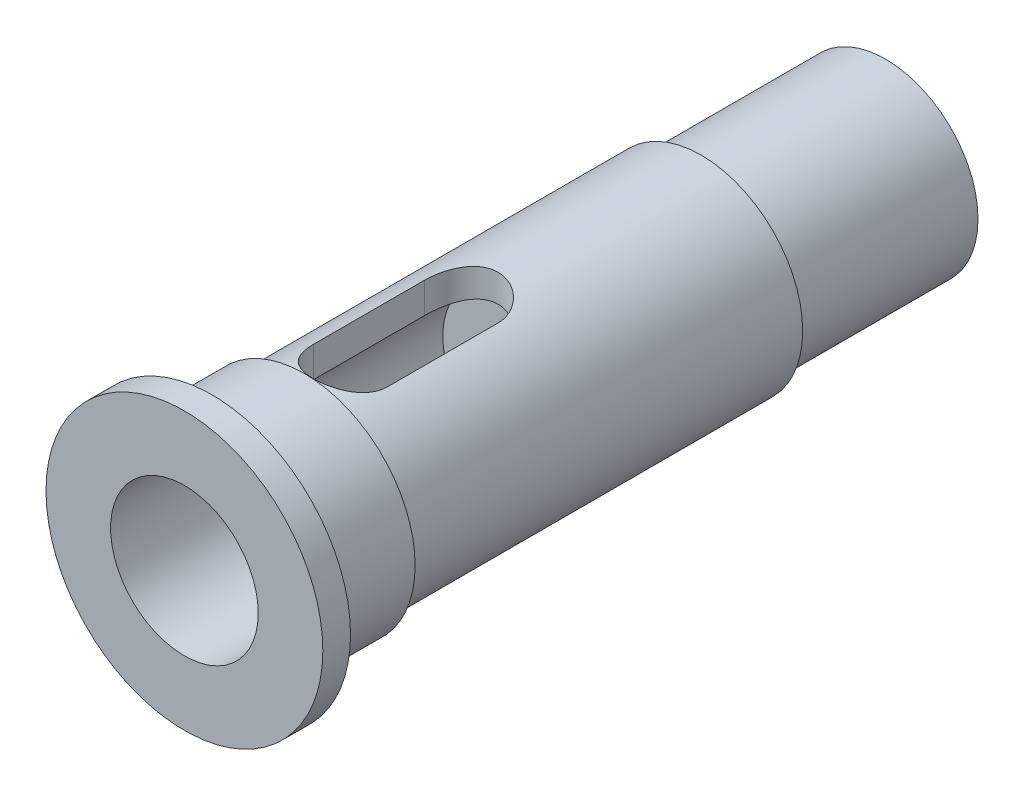
from build123d import *

# Parameters (mm, degrees)
SKETCH1_R                    = 5.5
BOSS_EXTRUDE1_DEPTH          = 38
SKETCH8_R                    = 7.5
BOSS_EXTRUDE2_DEPTH          = 1.5
SKETCH9_R                    = 6
BOSS_EXTRUDE3_DEPTH          = 5
SKETCH2_R                    = 4
CUT_EXTRUDE1_DEPTH           = 18
KEYWAY_SLOT_DEPTH            = 2.5
SKETCH11_OUTSIDE_W           = 25.704
SKETCH11_OUTSIDE_H           = 25.704
SKETCH11_OUTSIDE_R           = 5
TRIM_FOR_M10_WHEEL_NUT_DEPTH = 10


with BuildPart() as part:
    # Sketch1 → Boss-Extrude1 (new body)
    with BuildSketch(Plane.XY):
        Circle(SKETCH1_R)
    extrude(amount=BOSS_EXTRUDE1_DEPTH)

    # Sketch8 → Boss-Extrude2 (add)
    with BuildSketch(Plane.XY.offset(38)):
        Circle(SKETCH8_R)
    extrude(amount=-BOSS_EXTRUDE2_DEPTH)

    # Sketch9 → Boss-Extrude3 (add)
    with BuildSketch(Plane(origin=(0, 0, 36.5), x_dir=(-1, 0, 0), z_dir=(0, 0, -1))):
        with Locations(Location((0, 0, 0), (0, 0, 180))):
            Circle(SKETCH9_R)
    extrude(amount=BOSS_EXTRUDE3_DEPTH)

    # Sketch2 → Cut-Extrude1 (cut)
    with BuildSketch(Plane.XY.offset(38)):
        Circle(SKETCH2_R)
    extrude(amount=-CUT_EXTRUDE1_DEPTH, mode=Mode.SUBTRACT)

    # Sketch7 → Keyway slot (cut)
    with BuildSketch(Plane(origin=(0, 5.5, 0), x_dir=(1, 0, 0), z_dir=(0, 1, 0))):
        with BuildLine():
            Line((-2, -29), (-2, -23))
            ThreePointArc((-2, -23), (0, -21), (2, -23))
            Line((2, -23), (2, -29))
            ThreePointArc((2, -29), (0, -31), (-2, -29))
        make_face()
    extrude(amount=-KEYWAY_SLOT_DEPTH, mode=Mode.SUBTRACT)

    # Sketch11 outside → Trim for M10 wheel nut (cut)
    with BuildSketch(Plane(origin=(0, 0, 0), x_dir=(-1, 0, 0), z_dir=(0, 0, -1))):
        Rectangle(SKETCH11_OUTSIDE_W, SKETCH11_OUTSIDE_H)
        Circle(SKETCH11_OUTSIDE_R, mode=Mode.SUBTRACT)
    extrude(amount=-TRIM_FOR_M10_WHEEL_NUT_DEPTH, mode=Mode.SUBTRACT)


solid = part.part
